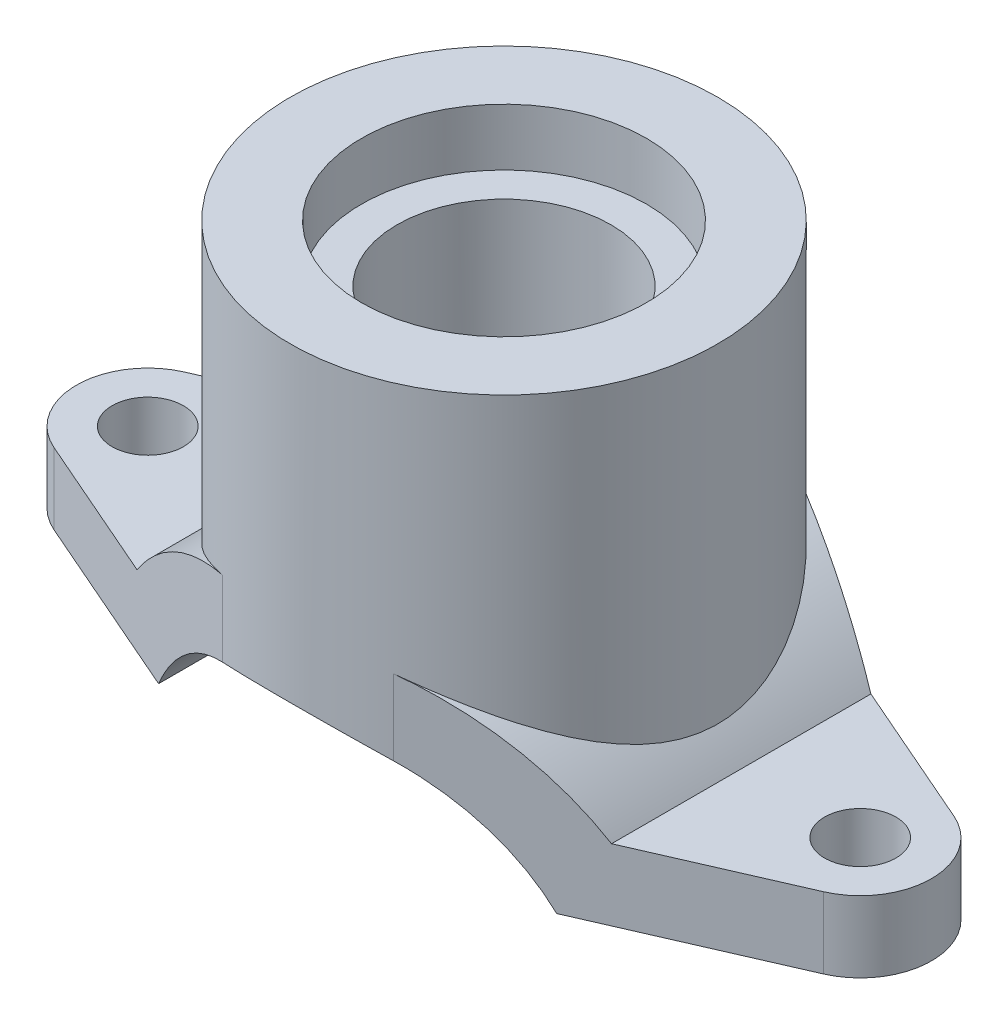
from build123d import *

# Parameters (mm, degrees)
BOSS_EXTRUDE1_DEPTH = 75
SKETCH3_OUTSIDE_W   = 370.368
SKETCH3_OUTSIDE_H   = 220.368
SKETCH3_OUTSIDE_R   = 12.5
CUT_EXTRUDE1_DEPTH  = 150
BOSS_EXTRUDE2_REACH = 227
SKETCH4_R           = 75
SKETCH6_R           = 37.5
CUT_EXTRUDE2_DEPTH  = 150
SKETCH7_R           = 50
CUT_EXTRUDE3_DEPTH  = 20


with BuildPart() as part:
    # Sketch2 → Boss-Extrude1 (new, symmetric)
    with BuildSketch(Plane.XY):
        with BuildLine():
            Line((-150, 0), (-69.84983894, 0))
            ThreePointArc((-69.84983894, 0), (0, 41), (69.84983894, 0))
            Line((69.84983894, 0), (150, 0))
            Line((150, 0), (150, 25))
            Line((150, 25), (83.240615087, 25))
            ThreePointArc((83.240615087, 25), (0, 66), (-83.240615087, 25))
            Line((-83.240615087, 25), (-150, 25))
            Line((-150, 25), (-150, 0))
        make_face()
    extrude(amount=BOSS_EXTRUDE1_DEPTH, both=True)

    # Sketch3 outside → Cut-Extrude1 (cut)
    # profile 1 of 3: a face of its own
    with BuildSketch(Plane.XZ):
        Rectangle(SKETCH3_OUTSIDE_W, SKETCH3_OUTSIDE_H)
        with BuildLine():
            Line((-135, 22.912878475), (-30, 68.738635424))
            ThreePointArc((-30, 68.738635424), (0, 75), (30, 68.738635424))
            Line((30, 68.738635424), (135, 22.912878475))
            ThreePointArc((135, 22.912878475), (150, 0), (135, -22.912878475))
            Line((135, -22.912878475), (30, -68.738635424))
            ThreePointArc((30, -68.738635424), (0, -75), (-30, -68.738635424))
            Line((-30, -68.738635424), (-135, -22.912878475))
            ThreePointArc((-135, -22.912878475), (-150, 0), (-135, 22.912878475))
        make_face(mode=Mode.SUBTRACT)
    # profile 2 of 3: a face of its own
    with BuildSketch(Plane.XZ):
        with Locations(Location((-125, 0, 0), (0, 0, 270))):
            Circle(SKETCH3_OUTSIDE_R)
    # profile 3 of 3: a face of its own
    with BuildSketch(Plane.XZ):
        with Locations(Location((125, 0, 0), (0, 0, 270))):
            Circle(SKETCH3_OUTSIDE_R)
    extrude(amount=-CUT_EXTRUDE1_DEPTH, mode=Mode.SUBTRACT)

    # Sketch4 → Boss-Extrude2 (add, up to next)
    with BuildSketch(Plane(origin=(0, 150, 0), x_dir=(-1, 0, 0), z_dir=(0, -1, 0)), mode=Mode.PRIVATE) as boss_extrude2_sk1:
        with Locations(Location((0, 0, 0), (0, 0, 90))):
            Circle(SKETCH4_R)
    boss_extrude2_tool1 = extrude(boss_extrude2_sk1.sketch, amount=BOSS_EXTRUDE2_REACH, mode=Mode.PRIVATE) - part.part
    add(boss_extrude2_tool1.solids().sort_by_distance((0, 150, 0))[0])

    # Sketch6 → Cut-Extrude2 (cut)
    with BuildSketch(Plane(origin=(0, 150, 0), x_dir=(-1, 0, 0), z_dir=(0, -1, 0))):
        with Locations(Location((0, 0, 0), (0, 0, 270))):
            Circle(SKETCH6_R)
    extrude(amount=CUT_EXTRUDE2_DEPTH, mode=Mode.SUBTRACT)

    # Sketch7 → Cut-Extrude3 (cut)
    with BuildSketch(Plane(origin=(0, 150, 0), x_dir=(-1, 0, 0), z_dir=(0, -1, 0))):
        with Locations(Location((0, 0, 0), (0, 0, 90))):
            Circle(SKETCH7_R)
    extrude(amount=CUT_EXTRUDE3_DEPTH, mode=Mode.SUBTRACT)


solid = part.part
